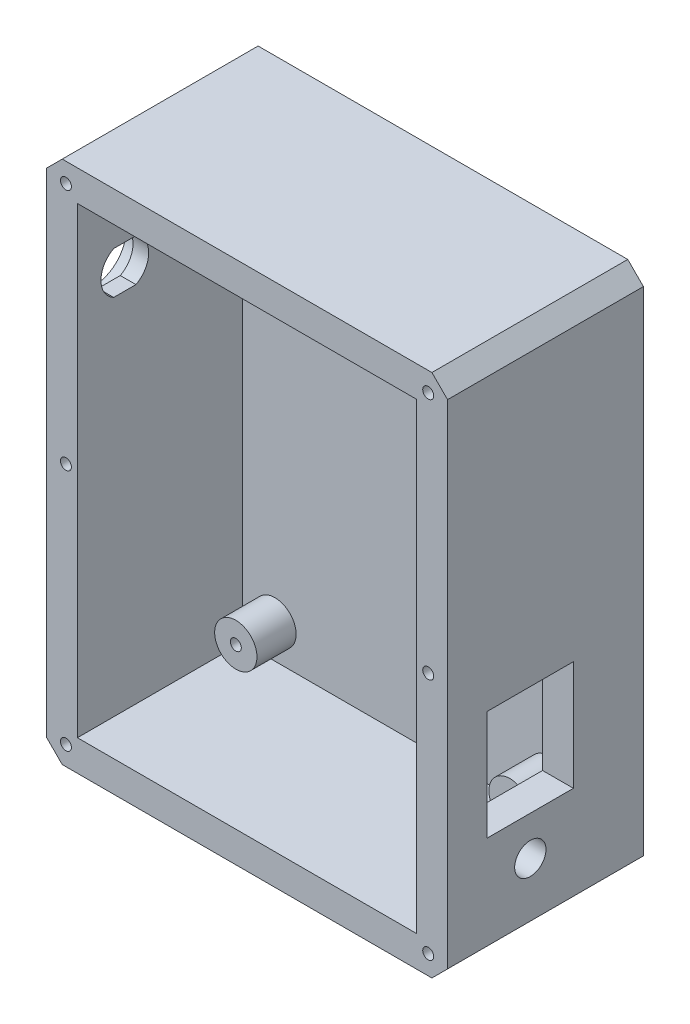
from build123d import *

# Parameters (mm, degrees)
SKETCH1_W           = 55
SKETCH1_H           = 75
SKETCH1_R           = 0.889
BOSS_EXTRUDE1_DEPTH = 5
SKETCH2_W           = 65
SKETCH2_H           = 85
SKETCH2_W_2         = 55
SKETCH2_H_2         = 75
BOSS_EXTRUDE2_DEPTH = 31.75
CUT_EXTRUDE1_REACH  = 85.901
SKETCH4_R           = 5.207
CUT_EXTRUDE2_DEPTH  = 2.46
CHAMFER1_SIZE       = 2.54
SKETCH5_R           = 0.889
CUT_EXTRUDE3_DEPTH  = 19.05
SKETCH6_R           = 3.429
SKETCH6_R_2         = 0.889
BOSS_EXTRUDE3_DEPTH = 6.35
CUT_EXTRUDE4_REACH  = 85.901
SKETCH7_W           = 13.97
SKETCH7_H           = 17.78
CUT_EXTRUDE5_REACH  = 85.901
SKETCH8_R           = 2.54


with BuildPart() as part:
    # Sketch1 → Boss-Extrude1 (new body)
    with BuildSketch(Plane.XY):
        Rectangle(SKETCH1_W, SKETCH1_H)
        with Locations((-22.225, 32.004)):
            Circle(SKETCH1_R, mode=Mode.SUBTRACT)
        with Locations(Location((-22.225, -32.004, 0), (0, 0, 180))):
            Circle(SKETCH1_R, mode=Mode.SUBTRACT)
        with Locations((22.225, -32.004)):
            Circle(SKETCH1_R, mode=Mode.SUBTRACT)
        with Locations(Location((22.225, 32.004, 0), (0, 0, 180))):
            Circle(SKETCH1_R, mode=Mode.SUBTRACT)
    extrude(amount=BOSS_EXTRUDE1_DEPTH)

    # Sketch2 → Boss-Extrude2 (add)
    with BuildSketch(Plane(origin=(0, 0, 0), x_dir=(-1, 0, 0), z_dir=(0, 0, -1))):
        Rectangle(SKETCH2_W, SKETCH2_H)
        Rectangle(SKETCH2_W_2, SKETCH2_H_2, mode=Mode.SUBTRACT)
    extrude(amount=-BOSS_EXTRUDE2_DEPTH)

    # Sketch3 → Cut-Extrude1 (cut, up to next)
    with BuildSketch(Plane.ZY.offset(32.5), mode=Mode.PRIVATE) as cut_extrude1_sk1:
        with BuildLine():
            Line((25.868155142, 21.371), (22.264844858, 21.371))
            ThreePointArc((22.264844858, 21.371), (20.193, 24.8), (22.264844858, 28.229))
            Line((22.264844858, 28.229), (25.868155142, 28.229))
            ThreePointArc((25.868155142, 28.229), (27.94, 24.8), (25.868155142, 21.371))
        make_face()
    cut_extrude1_tool1 = extrude(cut_extrude1_sk1.sketch, amount=-CUT_EXTRUDE1_REACH, mode=Mode.PRIVATE) & part.part
    add(cut_extrude1_tool1.solids().sort_by_distance((-32.5, 24.8, 24.0665))[0], mode=Mode.SUBTRACT)

    # Sketch4 → Cut-Extrude2 (cut)
    with BuildSketch(Plane.ZY.offset(32.5)):
        with Locations((24.0665, 24.8)):
            Circle(SKETCH4_R)
    extrude(amount=-CUT_EXTRUDE2_DEPTH, mode=Mode.SUBTRACT)

    # Chamfer1
    chamfer1_edges = [part.edges().sort_by_distance(p)[0] for p in [
        (32.5, 42.5, 15.875),
        (-32.5, 42.5, 15.875),
        (-32.5, -42.5, 15.875),
        (32.5, -42.5, 15.875),
    ]]
    chamfer(chamfer1_edges, length=CHAMFER1_SIZE)

    # Sketch5 → Cut-Extrude3 (cut)
    with BuildSketch(Plane.XY.offset(31.75)):
        with Locations((29.365, 39.365)):
            Circle(SKETCH5_R)
        with Locations((29.365, -39.365)):
            Circle(SKETCH5_R)
        with Locations((-29.365, -39.365)):
            Circle(SKETCH5_R)
        with Locations((-29.365, 39.365)):
            Circle(SKETCH5_R)
        with Locations((29.365, 0)):
            Circle(SKETCH5_R)
        with Locations((-29.365, 0)):
            Circle(SKETCH5_R)
    extrude(amount=-CUT_EXTRUDE3_DEPTH, mode=Mode.SUBTRACT)

    # Sketch6 → Boss-Extrude3 (add)
    # profile 1 of 4: a face of its own
    with BuildSketch(Plane.XY.offset(5)):
        with Locations(Location((-22.225, 32.004, 0), (0, 0, 180))):
            Circle(SKETCH6_R)
        with Locations((-22.225, 32.004)):
            Circle(SKETCH6_R_2, mode=Mode.SUBTRACT)
    # profile 2 of 4: a face of its own
    with BuildSketch(Plane.XY.offset(5)):
        with Locations(Location((-22.225, -32.004, 0), (0, 0, 180))):
            Circle(SKETCH6_R)
        with Locations(Location((-22.225, -32.004, 0), (0, 0, 180))):
            Circle(SKETCH6_R_2, mode=Mode.SUBTRACT)
    # profile 3 of 4: a face of its own
    with BuildSketch(Plane.XY.offset(5)):
        with Locations(Location((22.225, -32.004, 0), (0, 0, 180))):
            Circle(SKETCH6_R)
        with Locations((22.225, -32.004)):
            Circle(SKETCH6_R_2, mode=Mode.SUBTRACT)
    # profile 4 of 4: a face of its own
    with BuildSketch(Plane.XY.offset(5)):
        with Locations(Location((22.225, 32.004, 0), (0, 0, 180))):
            Circle(SKETCH6_R)
        with Locations(Location((22.225, 32.004, 0), (0, 0, 180))):
            Circle(SKETCH6_R_2, mode=Mode.SUBTRACT)
    extrude(amount=BOSS_EXTRUDE3_DEPTH)

    # Sketch7 → Cut-Extrude4 (cut, up to next)
    with BuildSketch(Plane(origin=(32.5, 0, 0), x_dir=(0, 0, -1), z_dir=(1, 0, 0)), mode=Mode.PRIVATE) as cut_extrude4_sk1:
        with Locations((-18.335, -15.91)):
            Rectangle(SKETCH7_W, SKETCH7_H)
    cut_extrude4_tool1 = extrude(cut_extrude4_sk1.sketch, amount=-CUT_EXTRUDE4_REACH, mode=Mode.PRIVATE) & part.part
    add(cut_extrude4_tool1.solids().sort_by_distance((32.5, -15.91, 18.335))[0], mode=Mode.SUBTRACT)

    # Sketch8 → Cut-Extrude5 (cut, up to next)
    with BuildSketch(Plane(origin=(32.5, 0, 0), x_dir=(0, 0, -1), z_dir=(1, 0, 0)), mode=Mode.PRIVATE) as cut_extrude5_sk1:
        with Locations((-18.335, -31.15)):
            Circle(SKETCH8_R)
    cut_extrude5_tool1 = extrude(cut_extrude5_sk1.sketch, amount=-CUT_EXTRUDE5_REACH, mode=Mode.PRIVATE) & part.part
    add(cut_extrude5_tool1.solids().sort_by_distance((32.5, -31.15, 18.335))[0], mode=Mode.SUBTRACT)


solid = part.part
